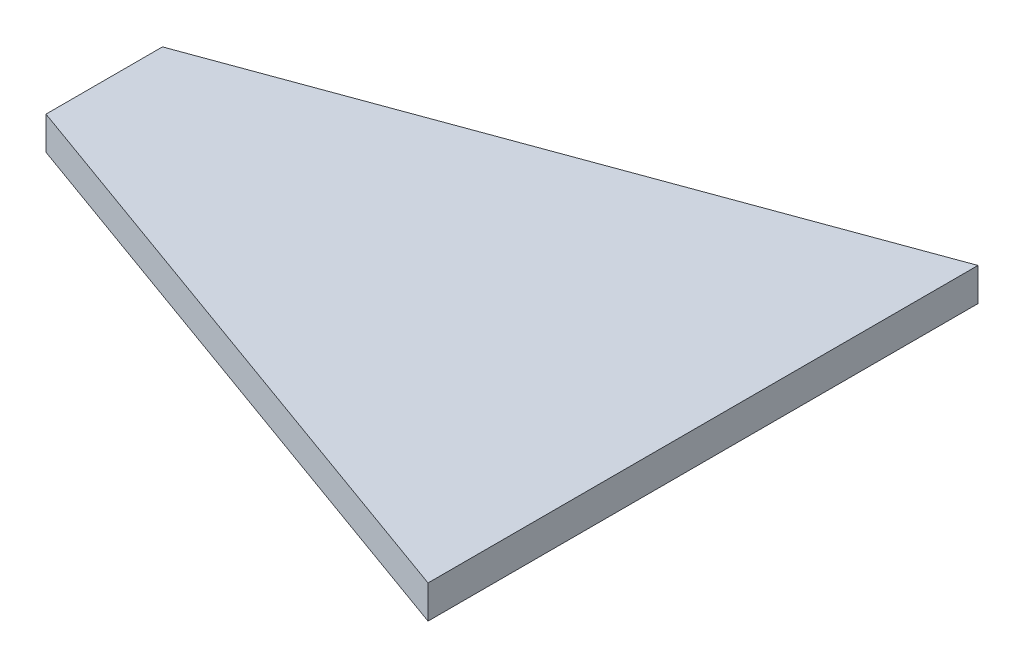
from build123d import *

# Parameters (mm, degrees)
EXTRU_MINCE1_DEPTH = 10
BOSS_EXTRU_1_DEPTH = 1


with BuildPart() as part:
    # Esquisse1 → Extru.-Mince1 (new body)
    with BuildSketch(Plane(origin=(0, 0, 0), x_dir=(1, 0, 0), z_dir=(0, 1, 0))):
        Polygon((225.762963936, -90.882191775), (27.185876504, -19.369864417), (27.185876504, 19.364097393), (225.762963936, 92.035383262), align=None)
        Polygon((224.262963936, -88.747703615), (28.685876504, -18.315747537), (28.685876504, 18.315747537), (224.262963936, 89.889153179), align=None, mode=Mode.SUBTRACT)
    extrude(amount=EXTRU_MINCE1_DEPTH)

    # Esquisse2 → Boss.-Extru.1 (add)
    with BuildSketch(Plane(origin=(0, 10, 0), x_dir=(1, 0, 0), z_dir=(0, 1, 0))):
        Polygon((225.762963936, -90.882191775), (225.762963936, 92.035383262), (27.185876504, 19.364097393), (27.185876504, -19.369864417), align=None)
    extrude(amount=BOSS_EXTRU_1_DEPTH)


solid = part.part
